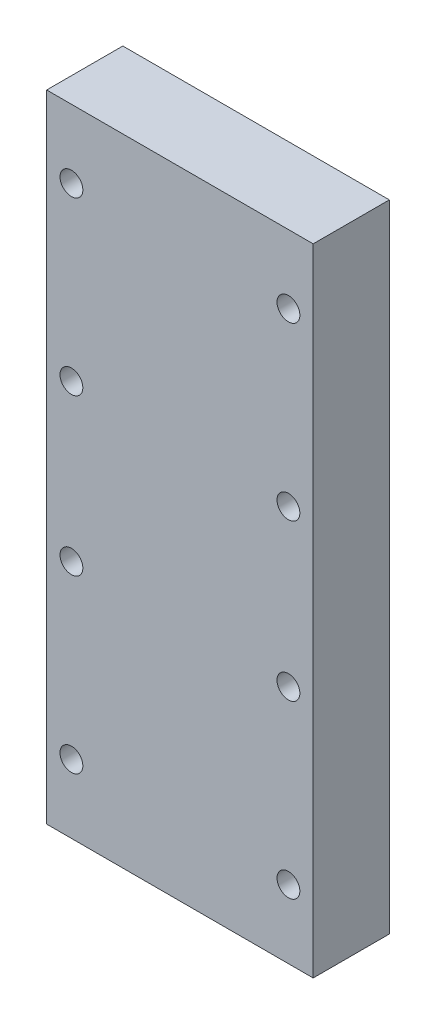
from build123d import *

# Parameters (mm, degrees)
SCHIZZO1_W                   = 70
SCHIZZO1_H                   = 167
ESTRUSIONE_ESTRUSIONE1_DEPTH = 20
SCHIZZO2_R                   = 3
TAGLIO_ESTRUSIONE1_DEPTH     = 20


with BuildPart() as part:
    # Schizzo1 → Estrusione-Estrusione1 (new body)
    with BuildSketch(Plane.XY):
        Rectangle(SCHIZZO1_W, SCHIZZO1_H)
    extrude(amount=ESTRUSIONE_ESTRUSIONE1_DEPTH)

    # Schizzo2 → Taglio-Estrusione1 (cut)
    with BuildSketch(Plane(origin=(0, 0, 0), x_dir=(-1, 0, 0), z_dir=(0, 0, -1))):
        with Locations((-28.5, 65.5)):
            Circle(SCHIZZO2_R)
        with Locations((28.5, 65.5)):
            Circle(SCHIZZO2_R)
        with Locations((-28.5, 20.5)):
            Circle(SCHIZZO2_R)
        with Locations((28.5, 20.5)):
            Circle(SCHIZZO2_R)
        with Locations((-28.5, -20.5)):
            Circle(SCHIZZO2_R)
        with Locations((28.5, -20.5)):
            Circle(SCHIZZO2_R)
        with Locations((-28.5, -65.5)):
            Circle(SCHIZZO2_R)
        with Locations((28.5, -65.5)):
            Circle(SCHIZZO2_R)
    extrude(amount=-TAGLIO_ESTRUSIONE1_DEPTH, mode=Mode.SUBTRACT)


solid = part.part
